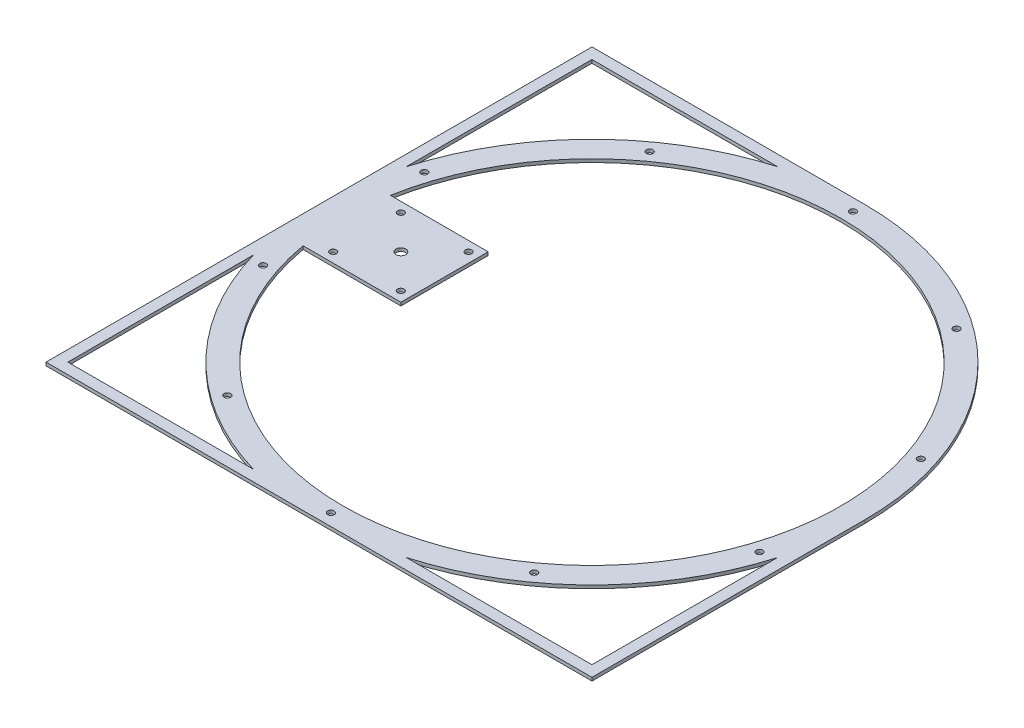
from build123d import *

# Parameters (mm, degrees)
SKETCH1_W           = 250
SKETCH1_H           = 250
SKETCH1_R           = 1.5
BOSS_EXTRUDE1_DEPTH = 1.5
SKETCH2_R           = 2.25
SKETCH2_R_2         = 1.5
CUT_EXTRUDE1_DEPTH  = 2
CUT_EXTRUDE2_DEPTH  = 2
CUT_EXTRUDE3_DEPTH  = 2


with BuildPart() as part:
    # Sketch1 → Boss-Extrude1 (new body)
    with BuildSketch(Plane(origin=(0, 0, 0), x_dir=(1, 0, 0), z_dir=(0, 1, 0))):
        with Locations((-125, -125)):
            Rectangle(SKETCH1_W, SKETCH1_H)
        with Locations(Location((-125, -5.475, 0), (0, 0, 270))):
            Circle(SKETCH1_R, mode=Mode.SUBTRACT)
        with Locations(Location((-11.32496989, -88.064743747, 0), (0, 0, 270))):
            Circle(SKETCH1_R, mode=Mode.SUBTRACT)
        with Locations(Location((-54.74496772, -28.302243747, 0), (0, 0, 270))):
            Circle(SKETCH1_R, mode=Mode.SUBTRACT)
        with Locations(Location((-11.32496989, -161.935256253, 0), (0, 0, 270))):
            Circle(SKETCH1_R, mode=Mode.SUBTRACT)
        with Locations(Location((-54.74496772, -221.697756253, 0), (0, 0, 269.999999999))):
            Circle(SKETCH1_R, mode=Mode.SUBTRACT)
        with Locations(Location((-125, -244.525, 0), (0, 0, 270))):
            Circle(SKETCH1_R, mode=Mode.SUBTRACT)
        with Locations(Location((-195.25503228, -221.697756253, 0), (0, 0, 269.999999999))):
            Circle(SKETCH1_R, mode=Mode.SUBTRACT)
        with Locations(Location((-238.67503011, -161.935256253, 0), (0, 0, 270))):
            Circle(SKETCH1_R, mode=Mode.SUBTRACT)
        with Locations(Location((-238.67503011, -88.064743747, 0), (0, 0, 270))):
            Circle(SKETCH1_R, mode=Mode.SUBTRACT)
        with Locations(Location((-195.25503228, -28.302243747, 0), (0, 0, 270))):
            Circle(SKETCH1_R, mode=Mode.SUBTRACT)
    extrude(amount=BOSS_EXTRUDE1_DEPTH)

    # Sketch2 → Cut-Extrude1 (cut)
    with BuildSketch(Plane(origin=(0, 1.5, 0), x_dir=(1, 0, 0), z_dir=(0, 1, 0))):
        with Locations(Location((-212.5, -125, 0), (0, 0, 270))):
            Circle(SKETCH2_R)
        with Locations(Location((-228, -140.5, 0), (0, 0, 270))):
            Circle(SKETCH2_R_2)
        with Locations(Location((-228, -109.5, 0), (0, 0, 270))):
            Circle(SKETCH2_R_2)
        with Locations(Location((-197, -109.5, 0), (0, 0, 270))):
            Circle(SKETCH2_R_2)
        with Locations(Location((-197, -140.5, 0), (0, 0, 270))):
            Circle(SKETCH2_R_2)
    extrude(amount=-CUT_EXTRUDE1_DEPTH, mode=Mode.SUBTRACT)

    # Sketch3 → Cut-Extrude2 (cut)
    with BuildSketch(Plane(origin=(0, 1.5, 0), x_dir=(1, 0, 0), z_dir=(0, 1, 0))):
        with BuildLine():
            ThreePointArc((-245, -90), (-213.388347648, -36.611652352), (-160, -5))
            Line((-160, -5), (-245, -5))
            Line((-245, -5), (-245, -90))
        make_face()
        with BuildLine():
            ThreePointArc((-160, -245), (-213.388347648, -213.388347648), (-245, -160))
            Line((-245, -160), (-245, -245))
            Line((-245, -245), (-160, -245))
        make_face()
        with BuildLine():
            Line((-5, -245), (-5, -160))
            ThreePointArc((-5, -160), (-36.611652352, -213.388347648), (-90, -245))
            Line((-90, -245), (-5, -245))
        make_face()
        with BuildLine():
            Line((-5, -5), (-90, -5))
            ThreePointArc((-90, -5), (-36.611652352, -36.611652352), (-5, -90))
            Line((-5, -90), (-5, -5))
        make_face()
        with BuildLine():
            ThreePointArc((-10.95, -125), (-44.354471606, -44.354471606), (-125, -10.95))
            ThreePointArc((-125, -10.95), (-198.233880479, -37.568877109), (-237.282690117, -105))
            Line((-237.282690117, -105), (-232.5, -105))
            Line((-232.5, -105), (-192.5, -105))
            Line((-192.5, -105), (-192.5, -145))
            Line((-192.5, -145), (-232.5, -145))
            Line((-232.5, -145), (-237.282690117, -145))
            ThreePointArc((-237.282690117, -145), (-114.961033616, -238.607313382), (-10.95, -125))
        make_face()
    extrude(amount=-CUT_EXTRUDE2_DEPTH, mode=Mode.SUBTRACT)

    # Sketch4 → Cut-Extrude3 (cut)
    with BuildSketch(Plane(origin=(0, 1.5, 0), x_dir=(1, 0, 0), z_dir=(0, 1, 0))):
        with BuildLine():
            Line((-125, 0), (0, 0))
            Line((0, 0), (0, -125))
            ThreePointArc((0, -125), (-36.611652352, -36.611652352), (-125, 0))
        make_face()
    extrude(amount=-CUT_EXTRUDE3_DEPTH, mode=Mode.SUBTRACT)


solid = part.part
